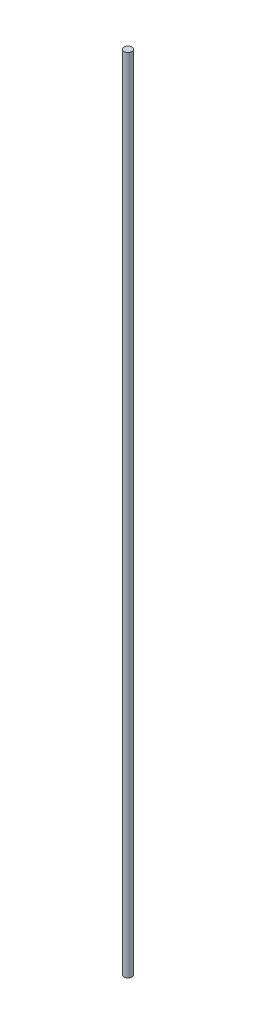
from build123d import *

# Parameters (mm, degrees)
SKETCH_1_R      = 4
EXTRUDE_1_DEPTH = 815


with BuildPart() as part:
    # Эскиз1 → Бобышка-Вытянуть1 (new body)
    with BuildSketch(Plane(origin=(0, 0, 0), x_dir=(1, 0, 0), z_dir=(0, 1, 0))):
        with Locations(Location((0, 0, 0), (0, 0, 270))):
            Circle(SKETCH_1_R)
    extrude(amount=EXTRUDE_1_DEPTH)


solid = part.part
